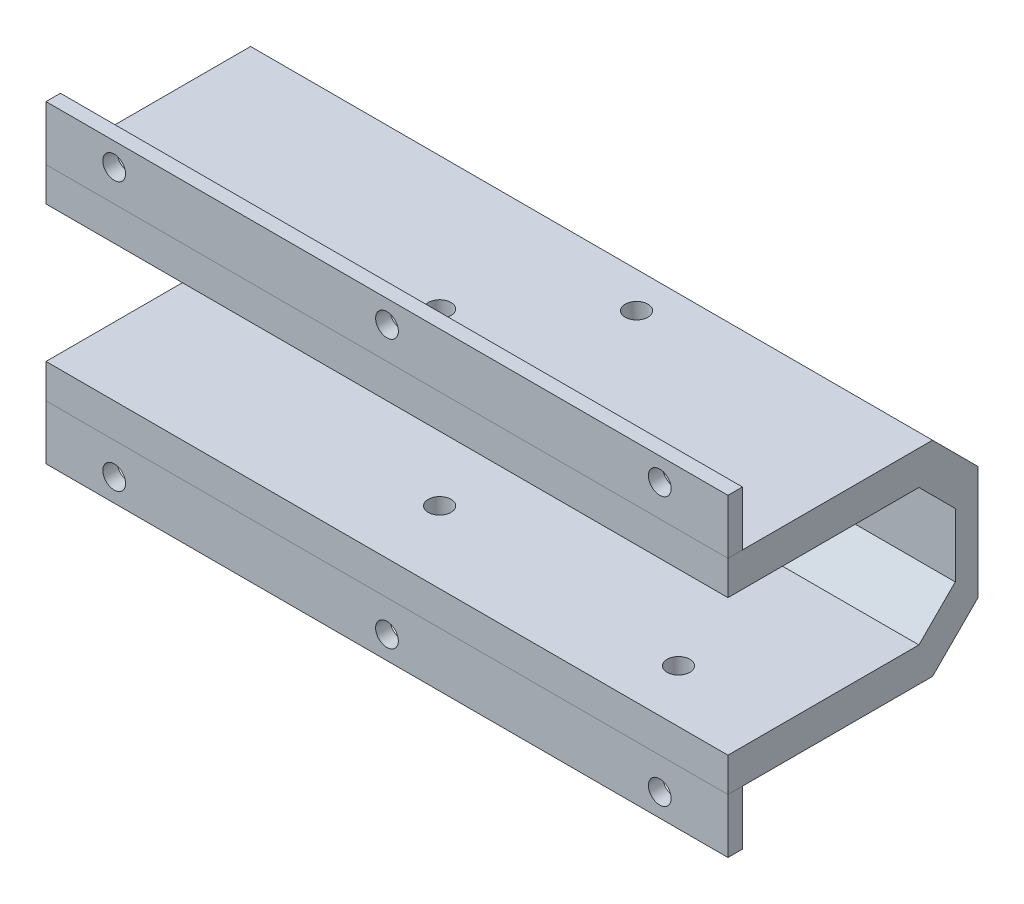
from build123d import *

# Parameters (mm, degrees)
SKETCH1_W               = 150
SKETCH1_H               = 45
BOSS_EXTRUDE1_DEPTH     = 55
CUT_EXTRUDE1_DEPTH      = 166.981926727
CUT_EXTRUDE1_DEPTH_BACK = 166.981926727
CHAMFER1_SIZE           = 10
SKETCH3_R               = 2.5
CUT_EXTRUDE2_DEPTH      = 166.981926727
SKETCH4_W               = 150
SKETCH4_H               = 12
SKETCH4_R               = 2.5
BOSS_EXTRUDE2_DEPTH     = 3.175
BOSS_EXTRUDE2_2_DEPTH   = 3.175


with BuildPart() as part:
    # Sketch1 → Boss-Extrude1 (new body)
    with BuildSketch(Plane.XY):
        with Locations((75, 22.5)):
            Rectangle(SKETCH1_W, SKETCH1_H)
    extrude(amount=BOSS_EXTRUDE1_DEPTH)

    # Sketch2 → Cut-Extrude1 (cut, two sides: drawn at the far end of the back side and taken through both)
    with BuildSketch(Plane(origin=(150, 0, 0), x_dir=(0, 0, -1), z_dir=(1, 0, 0)).offset(-CUT_EXTRUDE1_DEPTH_BACK)):
        Polygon((-13, 37.5), (-55, 37.5), (-55, 7.5), (-13, 7.5), (-5, 15.5), (-5, 29.5), align=None)
    extrude(amount=CUT_EXTRUDE1_DEPTH + CUT_EXTRUDE1_DEPTH_BACK, mode=Mode.SUBTRACT)

    # Chamfer1
    chamfer1_edges = [part.edges().sort_by_distance(p)[0] for p in [
        (75, 45, 0),
        (75, 0, 0),
    ]]
    chamfer(chamfer1_edges, length=CHAMFER1_SIZE)

    # Sketch3 → Cut-Extrude2 (cut, through all)
    with BuildSketch(Plane(origin=(0, 45, 0), x_dir=(1, 0, 0), z_dir=(0, 1, 0))):
        with Locations(Location((92.780741235, -17.882235423, 0), (0, 0, 270))):
            Circle(SKETCH3_R)
        with Locations(Location((127.534008193, -43.42184556, 0), (0, 0, 270))):
            Circle(SKETCH3_R)
        with Locations(Location((70.797279345, -39.219124905, 0), (0, 0, 270))):
            Circle(SKETCH3_R)
    extrude(amount=-CUT_EXTRUDE2_DEPTH, mode=Mode.SUBTRACT)


with BuildPart() as body_2:
    # Sketch4 → Boss-Extrude2 (new body)
    with BuildSketch(Plane.XY.offset(55)):
        with Locations((75, 51)):
            Rectangle(SKETCH4_W, SKETCH4_H)
        with Locations((15, 52)):
            Circle(SKETCH4_R, mode=Mode.SUBTRACT)
        with Locations((75, 52)):
            Circle(SKETCH4_R, mode=Mode.SUBTRACT)
        with Locations((135, 52)):
            Circle(SKETCH4_R, mode=Mode.SUBTRACT)
    extrude(amount=-BOSS_EXTRUDE2_DEPTH)


with BuildPart() as body_3:
    # Sketch4 → Boss-Extrude2 2 (new body)
    with BuildSketch(Plane.XY.offset(55)):
        with Locations((75, -6)):
            Rectangle(SKETCH4_W, SKETCH4_H)
        with Locations(Location((135, -7, 0), (0, 0, 180))):
            Circle(SKETCH4_R, mode=Mode.SUBTRACT)
        with Locations(Location((75, -7, 0), (0, 0, 180))):
            Circle(SKETCH4_R, mode=Mode.SUBTRACT)
        with Locations(Location((15, -7, 0), (0, 0, 180))):
            Circle(SKETCH4_R, mode=Mode.SUBTRACT)
    extrude(amount=-BOSS_EXTRUDE2_2_DEPTH)


solid = Compound([part.part, body_2.part, body_3.part])
